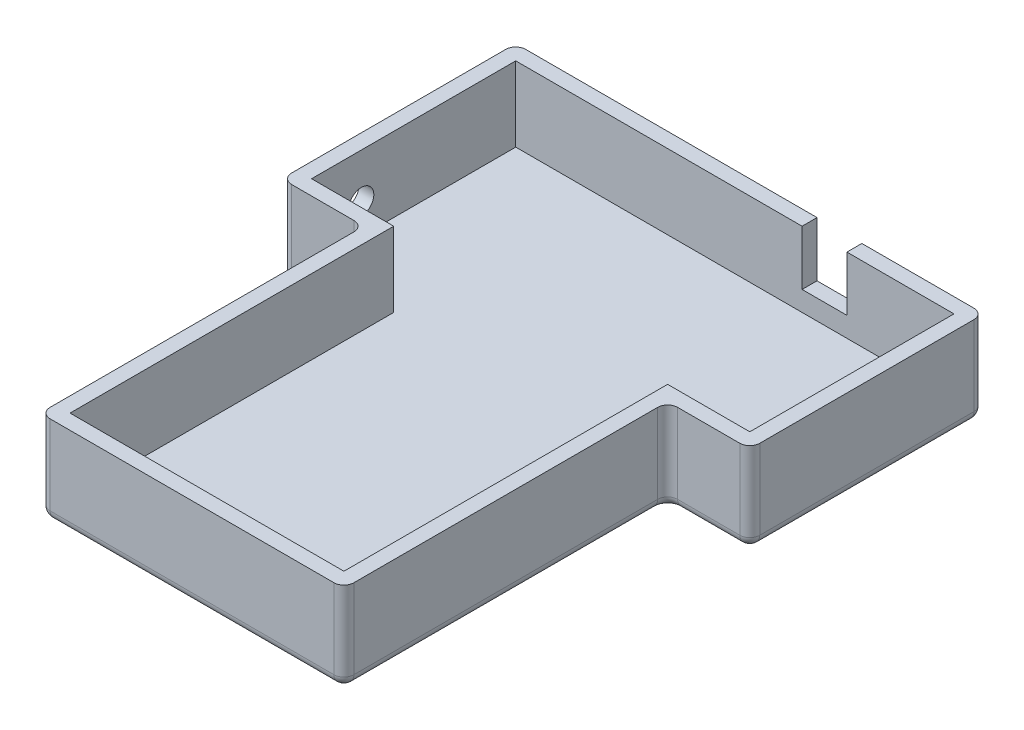
from build123d import *

# Parameters (mm, degrees)
BOSS_EXTRUDE1_DEPTH = 15
SHELL1_T            = 3
SKETCH3_W           = 9
SKETCH3_H           = 11
CUT_EXTRUDE1_DEPTH  = 3
SKETCH4_R           = 2.5
CUT_EXTRUDE2_DEPTH  = 3
FILLET1_R           = 2


with BuildPart() as part:
    # Sketch1 → Boss-Extrude1 (new body)
    with BuildSketch(Plane(origin=(0, 0, 0), x_dir=(1, 0, 0), z_dir=(0, 1, 0))):
        Polygon((0, 0), (88, 0), (88, -41), (71.5, -41), (71.5, -106), (16.5, -106), (16.5, -41), (0, -41), align=None)
    extrude(amount=BOSS_EXTRUDE1_DEPTH)

    # Shell1
    shell1_openings = [part.faces().sort_by_distance(p)[0] for p in [
        (44, 15, 46.878254211),
    ]]
    offset(amount=SHELL1_T, openings=shell1_openings, kind=Kind.INTERSECTION)

    # Sketch3 → Cut-Extrude1 (cut)
    with BuildSketch(Plane(origin=(0, 0, -3), x_dir=(-1, 0, 0), z_dir=(0, 0, -1))):
        with Locations((-62, 9.5)):
            Rectangle(SKETCH3_W, SKETCH3_H)
    extrude(amount=-CUT_EXTRUDE1_DEPTH, mode=Mode.SUBTRACT)

    # Sketch4 → Cut-Extrude2 (cut)
    with BuildSketch(Plane.ZY.offset(3)):
        with Locations((31, 6)):
            Circle(SKETCH4_R)
    extrude(amount=-CUT_EXTRUDE2_DEPTH, mode=Mode.SUBTRACT)

    # Fillet1
    fillet1_edges = [part.edges().sort_by_distance(p)[0] for p in [
        (44, -3, 109),
        (13.5, -3, 76.5),
        (5.25, -3, 44),
        (-3, -3, 20.5),
        (-3, 6, -3),
        (91, 6, -3),
        (91, 6, 44),
        (74.5, 6, 44),
        (74.5, 6, 109),
        (13.5, 6, 109),
        (13.5, 6, 44),
        (-3, 6, 44),
        (44, -3, -3),
        (91, -3, 20.5),
        (82.75, -3, 44),
        (74.5, -3, 76.5),
    ]]
    fillet(fillet1_edges, radius=FILLET1_R)


solid = part.part
